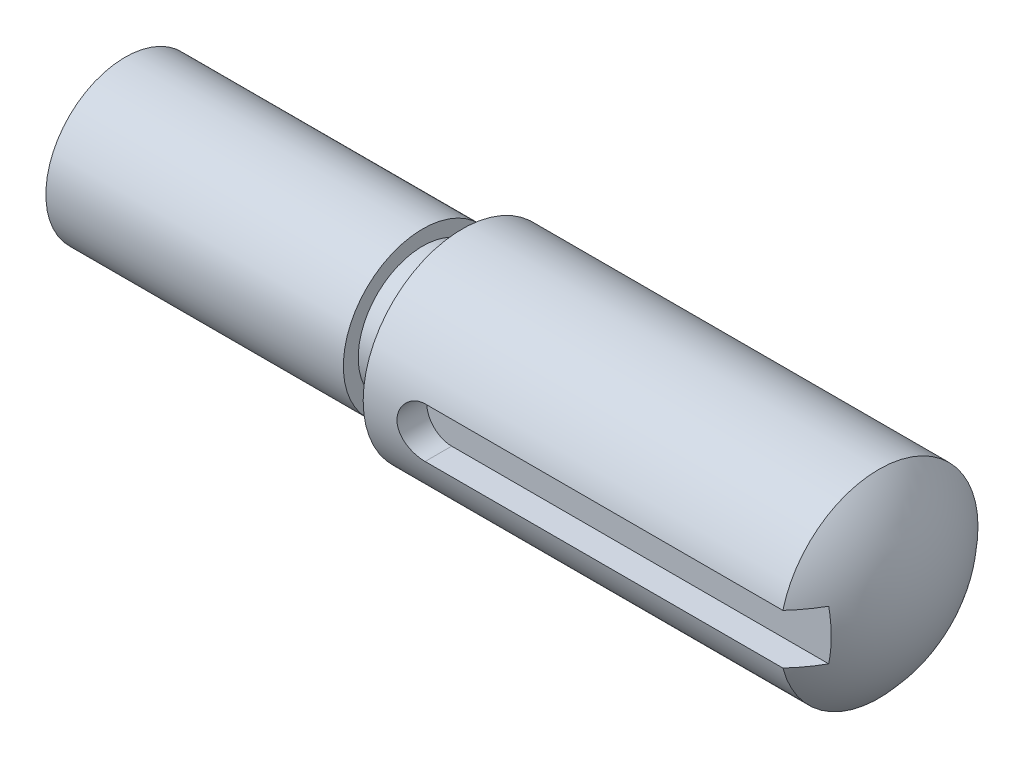
from build123d import *

# Parameters (mm, degrees)
ENL_V_MAT_EXTRU_1_DEPTH = 3


with BuildPart() as part:
    # Esquisse1 → Révolution1 (revolve)
    with BuildSketch(Plane.XY, mode=Mode.PRIVATE) as r_volution1_sk:
        with BuildLine():
            Line((80, 0), (0, 0))
            Line((0, 0), (0, 8))
            Line((0, 8), (30, 8))
            Line((30, 8), (30, 6.5))
            Line((30, 6.5), (34, 6.5))
            Line((34, 6.5), (34, 10))
            Line((34, 10), (76, 10))
            ThreePointArc((76, 10), (78.962912018, 5.385164807), (80, 0))
        make_face()
    revolve(r_volution1_sk.sketch.rotate(Axis((80, 0, 0), (-1, 0, 0)), 90), axis=Axis((80, 0, 0), (-1, 0, 0)))

    # Esquisse2 → Enlèv. mat.-Extru.1 (cut)
    with BuildSketch(Plane.XY.offset(10)):
        with BuildLine():
            Line((39.924742885, 2.51802815), (89.396583104, 2.51802815))
            Line((89.396583104, 2.51802815), (89.396583104, -2.514235284))
            Line((89.396583104, -2.514235284), (39.924742885, -2.514235284))
            ThreePointArc((39.924742885, -2.514235284), (37.408611168, 0.001896433), (39.924742885, 2.51802815))
        make_face()
    extrude(amount=-ENL_V_MAT_EXTRU_1_DEPTH, mode=Mode.SUBTRACT)


solid = part.part
